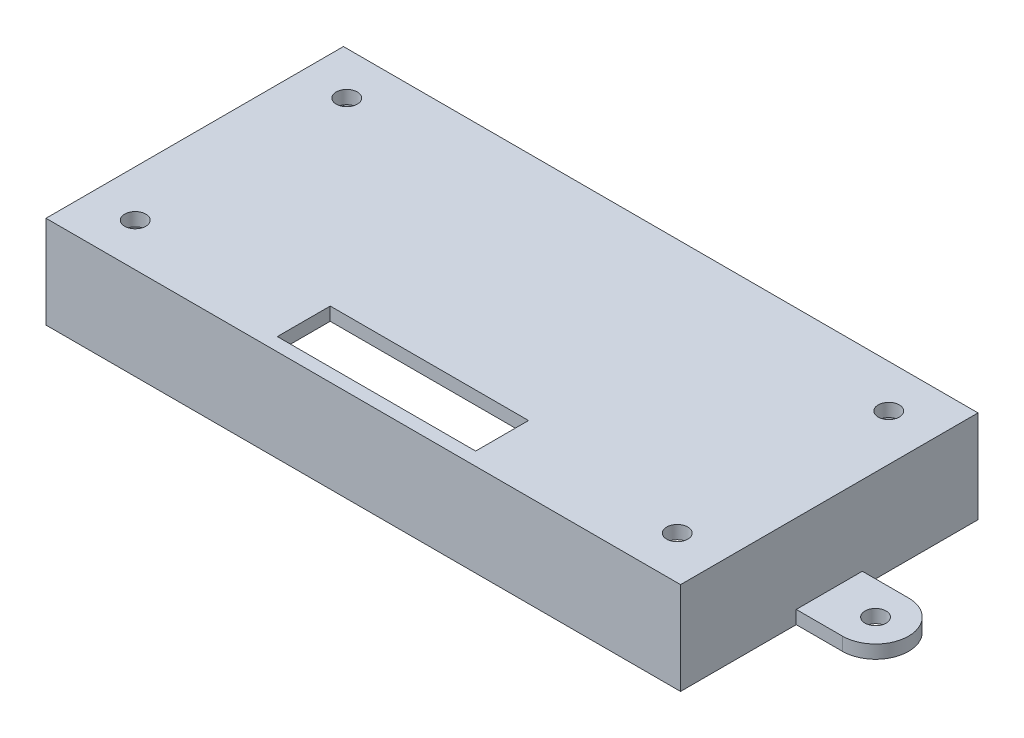
from build123d import *

# Parameters (mm, degrees)
SKETCH1_R           = 1.6
BOSS_EXTRUDE1_DEPTH = 2
SKETCH2_W           = 96
SKETCH2_H           = 45
SKETCH2_W_2         = 92
SKETCH2_H_2         = 41
BOSS_EXTRUDE2_DEPTH = 10
SKETCH3_W           = 92
SKETCH3_H           = 41
CUT_EXTRUDE1_DEPTH  = 65.855608855
SKETCH4_W           = 96
SKETCH4_H           = 45
BOSS_EXTRUDE3_DEPTH = 2
CUT_EXTRUDE2_DEPTH  = 66.193941436
SKETCH6_W           = 30
SKETCH6_H           = 8
CUT_EXTRUDE4_DEPTH  = 66.193941436


with BuildPart() as part:
    # Sketch1 → Boss-Extrude1 (new body)
    with BuildSketch(Plane(origin=(0, 0, 0), x_dir=(1, 0, 0), z_dir=(0, 1, 0))):
        with BuildLine():
            Line((-48, 5), (-55, 5))
            ThreePointArc((-55, 5), (-60, 0), (-55, -5))
            Line((-55, -5), (-48, -5))
            Line((-48, -5), (-48, -22.5))
            Line((-48, -22.5), (48, -22.5))
            Line((48, -22.5), (48, -5))
            Line((48, -5), (55, -5))
            ThreePointArc((55, -5), (60, 0), (55, 5))
            Line((55, 5), (48, 5))
            Line((48, 5), (48, 22.5))
            Line((48, 22.5), (-48, 22.5))
            Line((-48, 22.5), (-48, 5))
        make_face()
        with Locations(Location((-55, 0, 0), (0, 0, 270))):
            Circle(SKETCH1_R, mode=Mode.SUBTRACT)
        with Locations(Location((55, 0, 0), (0, 0, 270))):
            Circle(SKETCH1_R, mode=Mode.SUBTRACT)
    extrude(amount=BOSS_EXTRUDE1_DEPTH)

    # Sketch2 → Boss-Extrude2 (add)
    with BuildSketch(Plane(origin=(0, 2, 0), x_dir=(1, 0, 0), z_dir=(0, 1, 0))):
        Rectangle(SKETCH2_W, SKETCH2_H)
        Rectangle(SKETCH2_W_2, SKETCH2_H_2, mode=Mode.SUBTRACT)
    extrude(amount=BOSS_EXTRUDE2_DEPTH)

    # Sketch3 → Cut-Extrude1 (cut, through all)
    with BuildSketch(Plane(origin=(0, 2, 0), x_dir=(1, 0, 0), z_dir=(0, 1, 0))):
        Rectangle(SKETCH3_W, SKETCH3_H)
    extrude(amount=-CUT_EXTRUDE1_DEPTH, mode=Mode.SUBTRACT)

    # Sketch4 → Boss-Extrude3 (add)
    with BuildSketch(Plane(origin=(0, 12, 0), x_dir=(1, 0, 0), z_dir=(0, 1, 0))):
        Rectangle(SKETCH4_W, SKETCH4_H)
    extrude(amount=BOSS_EXTRUDE3_DEPTH)

    # Sketch5 → Cut-Extrude2 (cut, through all)
    with BuildSketch(Plane(origin=(0, 12, 0), x_dir=(-1, 0, 0), z_dir=(0, -1, 0))):
        with BuildLine():
            ThreePointArc((42.6, -16), (42.13137085, -14.86862915), (41, -14.4))
            Line((41, -14.4), (41, -16))
            Line((41, -16), (39.4, -16))
            ThreePointArc((39.4, -16), (41, -17.6), (42.6, -16))
        make_face()
        with BuildLine():
            Line((41, -16), (41, -14.4))
            ThreePointArc((41, -14.4), (39.86862915, -14.86862915), (39.4, -16))
            Line((39.4, -16), (41, -16))
        make_face()
        with BuildLine():
            ThreePointArc((42.6, 16), (41, 17.6), (39.4, 16))
            Line((39.4, 16), (41, 16))
            Line((41, 16), (41, 14.4))
            ThreePointArc((41, 14.4), (42.13137085, 14.86862915), (42.6, 16))
        make_face()
        with BuildLine():
            Line((41, 16), (39.4, 16))
            ThreePointArc((39.4, 16), (39.86862915, 14.86862915), (41, 14.4))
            Line((41, 14.4), (41, 16))
        make_face()
        with BuildLine():
            ThreePointArc((-41, 14.4), (-39.86862915, 14.86862915), (-39.4, 16))
            Line((-39.4, 16), (-41, 16))
            Line((-41, 16), (-41, 14.4))
        make_face()
        with BuildLine():
            Line((-41, 16), (-39.4, 16))
            ThreePointArc((-39.4, 16), (-42.13137085, 17.13137085), (-41, 14.4))
            Line((-41, 14.4), (-41, 16))
        make_face()
        with BuildLine():
            ThreePointArc((-39.4, -16), (-39.86862915, -14.86862915), (-41, -14.4))
            Line((-41, -14.4), (-41, -16))
            Line((-41, -16), (-39.4, -16))
        make_face()
        with BuildLine():
            Line((-41, -16), (-41, -14.4))
            ThreePointArc((-41, -14.4), (-42.13137085, -17.13137085), (-39.4, -16))
            Line((-39.4, -16), (-41, -16))
        make_face()
    extrude(amount=-CUT_EXTRUDE2_DEPTH, mode=Mode.SUBTRACT)

    # Sketch6 → Cut-Extrude4 (cut, through all)
    with BuildSketch(Plane(origin=(0, 12, 0), x_dir=(-1, 0, 0), z_dir=(0, -1, 0))):
        with Locations((0, -16.5)):
            Rectangle(SKETCH6_W, SKETCH6_H)
    extrude(amount=-CUT_EXTRUDE4_DEPTH, mode=Mode.SUBTRACT)


solid = part.part
